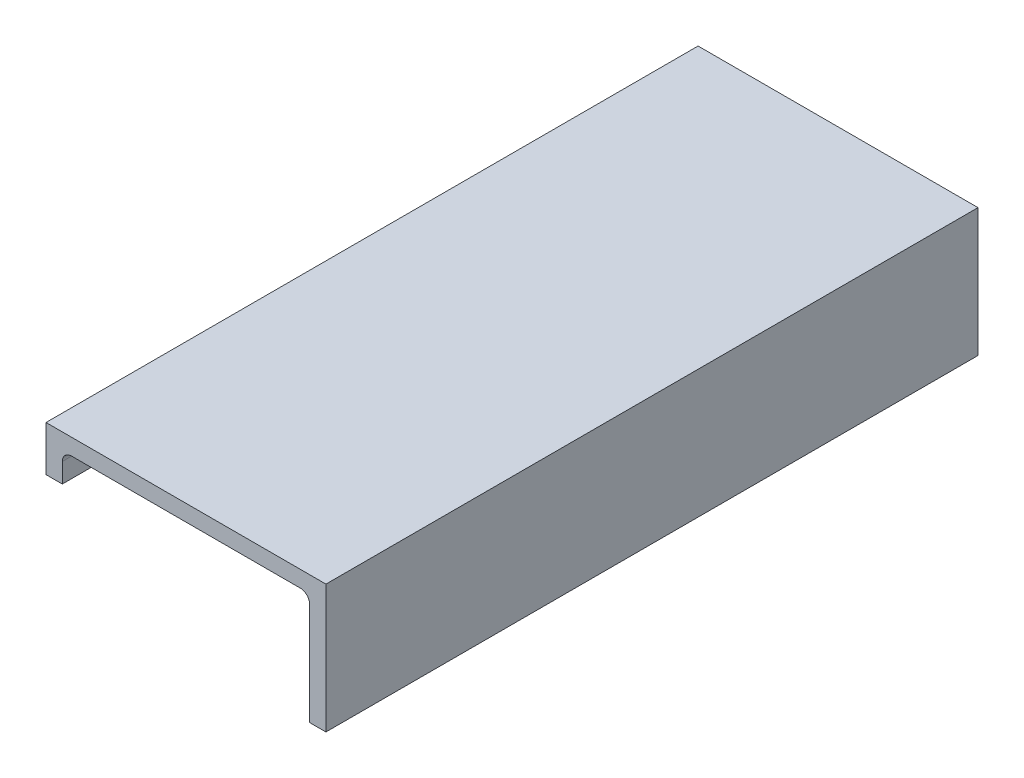
from build123d import *

# Parameters (mm, degrees)
BOSS_EXTRUDE1_DEPTH = 177.8
FILLET1_R           = 2.54
FILLET2_R           = 2.54


with BuildPart() as part:
    # Sketch1 → Boss-Extrude1 (new body)
    with BuildSketch(Plane.XY):
        Polygon((0, 0), (38.1635, 0), (38.1635, -34.925), (33.7185, -34.925), (33.7185, -4.445), (-33.7185, -4.445), (-33.7185, -12.319), (-38.1635, -12.319), (-38.1635, 0), align=None)
    extrude(amount=BOSS_EXTRUDE1_DEPTH)

    # Fillet1
    fillet1_edges = [part.edges().sort_by_distance(p)[0] for p in [
        (33.7185, -4.445, 88.9),
    ]]
    fillet(fillet1_edges, radius=FILLET1_R)

    # Fillet2
    fillet2_edges = [part.edges().sort_by_distance(p)[0] for p in [
        (-33.7185, -4.445, 88.9),
    ]]
    fillet(fillet2_edges, radius=FILLET2_R)


solid = part.part
